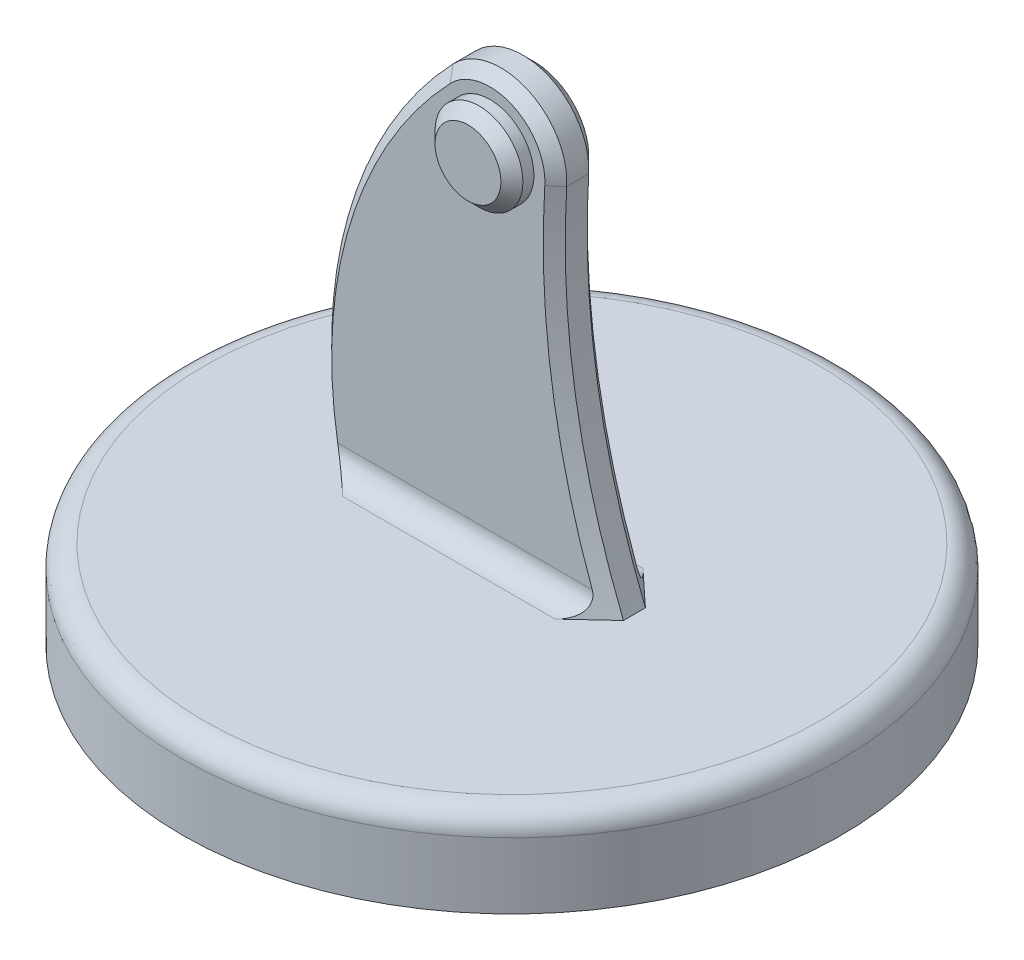
from build123d import *

# Parameters (mm, degrees)
SKETCH1_R           = 75
BOSS_EXTRUDE1_DEPTH = 20
FILLET1_R           = 5
BOSS_EXTRUDE2_DEPTH = 5
CHAMFER1_SIZE       = 2.5
FILLET2_R           = 5
SKETCH3_R           = 10
BOSS_EXTRUDE3_DEPTH = 5
CHAMFER2_SIZE       = 2.5
SKETCH4_R           = 5
CUT_EXTRUDE1_DEPTH  = 10


with BuildPart() as part:
    # Sketch1 → Boss-Extrude1 (new body)
    with BuildSketch(Plane(origin=(0, 0, 0), x_dir=(1, 0, 0), z_dir=(0, 1, 0))):
        with Locations(Location((0, 0, 0), (0, 0, 270))):
            Circle(SKETCH1_R)
    extrude(amount=BOSS_EXTRUDE1_DEPTH)

    # Fillet1
    fillet1_edges = [part.edges().sort_by_distance(p)[0] for p in [
        (0, 20, -75),
    ]]
    fillet(fillet1_edges, radius=FILLET1_R)

    # Sketch2 → Boss-Extrude2 (add, symmetric)
    with BuildSketch(Plane.XY):
        with BuildLine():
            Line((-35, 15), (30, 15))
            ThreePointArc((30, 15), (17.428098582, 56.126843631), (14.970645506, 99.06203778))
            ThreePointArc((14.970645506, 99.06203778), (6.012327577, 113.742340307), (-10.849201429, 110.358321696))
            ThreePointArc((-10.849201429, 110.358321696), (-35.460543036, 65.854059614), (-35, 15))
        make_face()
    extrude(amount=BOSS_EXTRUDE2_DEPTH, both=True)

    # Chamfer1
    chamfer1_edges = [part.edges().sort_by_distance(p)[0] for p in [
        (-34.796467261, 68.341174934, -5),
        (16.970295051, 58.803839559, -5),
        (6.012327577, 113.742340307, -5),
        (16.970295051, 58.803839559, 5),
        (6.012327577, 113.742340307, 5),
        (-34.796467261, 68.341174934, 5),
    ]]
    chamfer(chamfer1_edges, length=CHAMFER1_SIZE)

    # Fillet2
    fillet2_edges = [part.edges().sort_by_distance(p)[0] for p in [
        (-4.241511046, 20, -5),
        (-4.241511046, 20, 5),
    ]]
    fillet(fillet2_edges, radius=FILLET2_R)

    # Sketch3 → Boss-Extrude3 (add)
    with BuildSketch(Plane.XY.offset(5)):
        with Locations(Location((0, 100, 0), (0, 0, 180))):
            Circle(SKETCH3_R)
    extrude(amount=BOSS_EXTRUDE3_DEPTH)

    # Chamfer2
    chamfer2_edges = [part.edges().sort_by_distance(p)[0] for p in [
        (10, 100, 10),
    ]]
    chamfer(chamfer2_edges, length=CHAMFER2_SIZE)

    # Sketch4 → Cut-Extrude1 (cut)
    with BuildSketch(Plane(origin=(0, 0, -5), x_dir=(-1, 0, 0), z_dir=(0, 0, -1))):
        with Locations((0, 100)):
            Circle(SKETCH4_R)
    extrude(amount=-CUT_EXTRUDE1_DEPTH, mode=Mode.SUBTRACT)


solid = part.part
